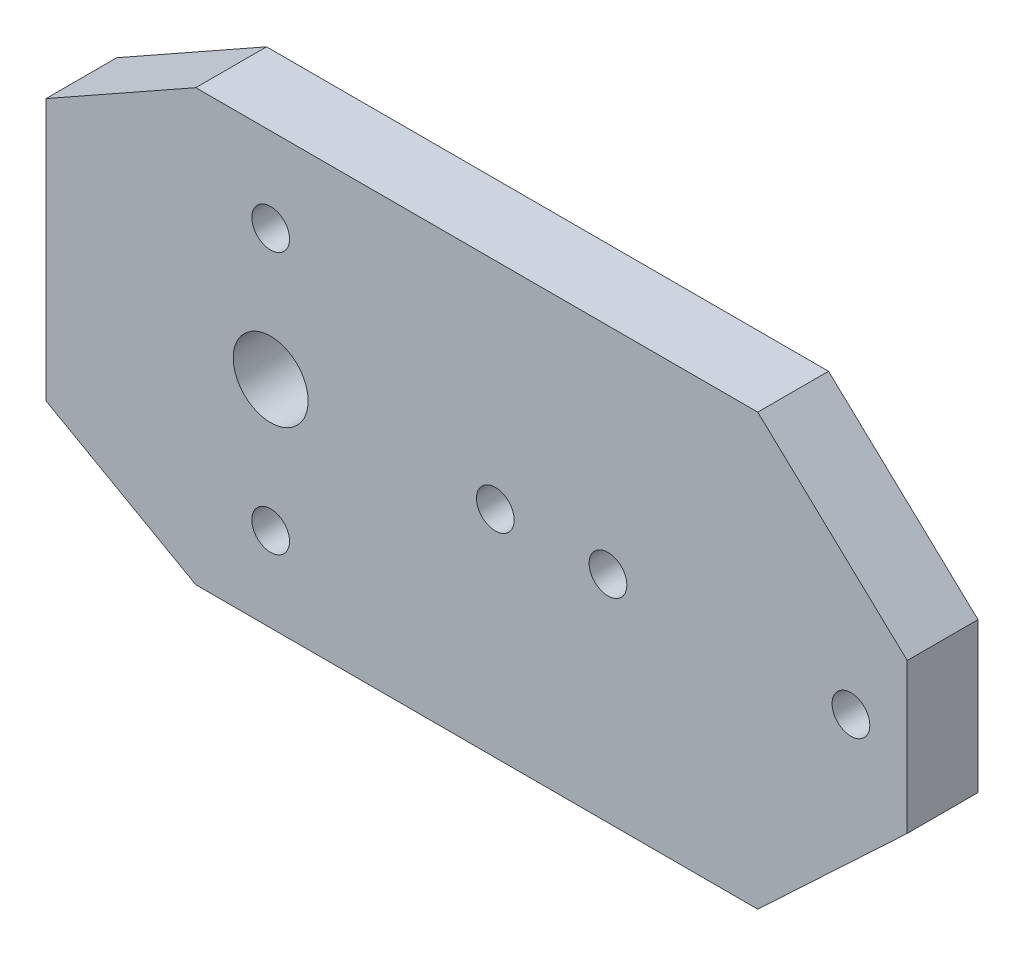
from build123d import *

# Parameters (mm, degrees)
SKETCH1_R           = 1.6
SKETCH1_R_2         = 3.175
BOSS_EXTRUDE1_DEPTH = 6


with BuildPart() as part:
    # Sketch1 → Boss-Extrude1 (new body)
    with BuildSketch(Plane.XY):
        Polygon((-19.05, -11.1), (-6.35, -18.25), (41.3, -18.25), (53.975, -6.35), (53.975, 6.35), (41.3, 18.25), (-6.35, 18.25), (-19.05, 11.1), align=None)
        with Locations((19.05, 0)):
            Circle(SKETCH1_R, mode=Mode.SUBTRACT)
        with Locations((28.6, 0)):
            Circle(SKETCH1_R, mode=Mode.SUBTRACT)
        with Locations((49.2, 0)):
            Circle(SKETCH1_R, mode=Mode.SUBTRACT)
        Circle(SKETCH1_R_2, mode=Mode.SUBTRACT)
        with Locations((0, 11.1)):
            Circle(SKETCH1_R, mode=Mode.SUBTRACT)
        with Locations((0, -11.1)):
            Circle(SKETCH1_R, mode=Mode.SUBTRACT)
    extrude(amount=BOSS_EXTRUDE1_DEPTH)


solid = part.part
